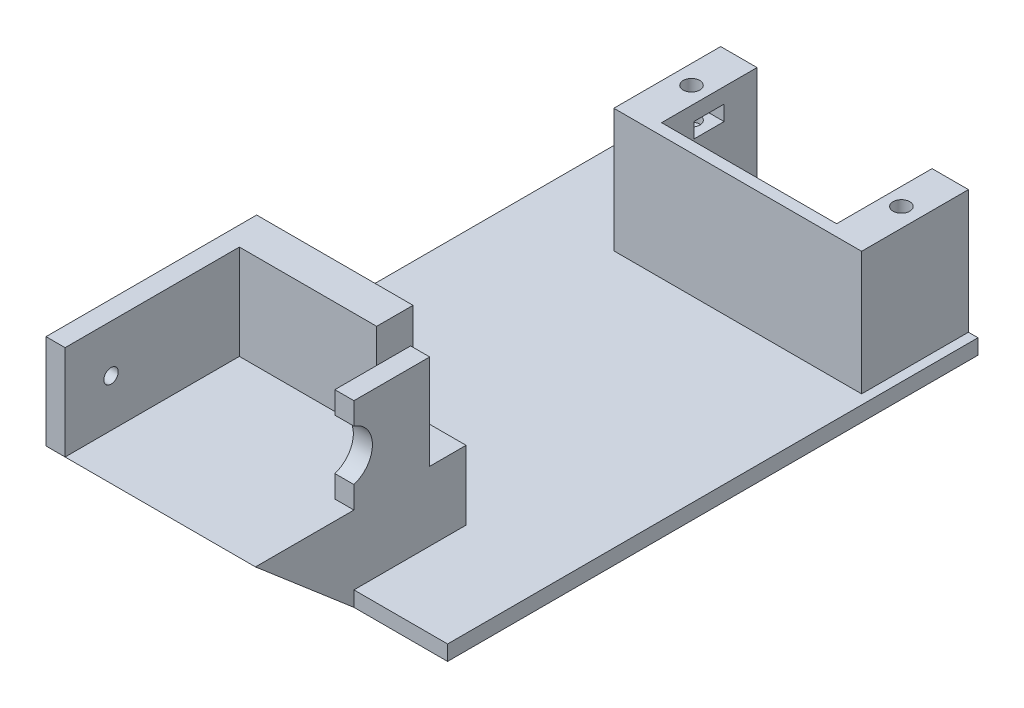
from build123d import *

# Parameters (mm, degrees)
SKETCH1_W           = 46
SKETCH1_H           = 70
BOSS_EXTRUDE1_DEPTH = 2
BOSS_EXTRUDE2_DEPTH = 16.3
SKETCH3_W           = 23.1
SKETCH3_H           = 12.6
CUT_EXTRUDE1_DEPTH  = 45.940961271
SKETCH4_W           = 34
SKETCH4_H           = 14.8
BOSS_EXTRUDE3_DEPTH = 11.125
BOSS_EXTRUDE4_DEPTH = 12.5
SKETCH7_W           = 6.36
SKETCH7_H           = 14.8
CUT_EXTRUDE2_DEPTH  = 9.125
SKETCH8_W           = 13
SKETCH8_H           = 12.5
SKETCH8_R           = 0.95
BOSS_EXTRUDE5_DEPTH = 2.52
BOSS_EXTRUDE6_DEPTH = 27.64
SKETCH10_W          = 7
SKETCH10_H          = 4.8
CUT_EXTRUDE3_DEPTH  = 12.5
SKETCH11_R          = 3.5
CUT_EXTRUDE4_DEPTH  = 10
SKETCH12_R          = 1.1
CUT_EXTRUDE5_DEPTH  = 8
CUT_EXTRUDE6_DEPTH  = 1.8
SKETCH14_R          = 1.1
CUT_EXTRUDE7_DEPTH  = 5
CUT_EXTRUDE8_DEPTH  = 2


with BuildPart() as part:
    # Sketch1 → Boss-Extrude1 (new body)
    with BuildSketch(Plane(origin=(0, 0, 0), x_dir=(1, 0, 0), z_dir=(0, 1, 0))):
        Rectangle(SKETCH1_W, SKETCH1_H)
    extrude(amount=BOSS_EXTRUDE1_DEPTH)

    # Sketch2 → Boss-Extrude2 (add)
    with BuildSketch(Plane(origin=(0, 2, 0), x_dir=(1, 0, 0), z_dir=(0, 1, 0))):
        Polygon((16.94, 22.4), (16.94, 35), (21.74, 35), (21.74, 20.9), (-10.96, 20.9), (-10.96, 35), (-6.16, 35), (-6.16, 22.4), align=None)
    extrude(amount=BOSS_EXTRUDE2_DEPTH)

    # Sketch3 → Cut-Extrude1 (cut, through all)
    with BuildSketch(Plane(origin=(0, 2, 0), x_dir=(1, 0, 0), z_dir=(0, 1, 0))):
        with Locations((5.39, 28.7)):
            Rectangle(SKETCH3_W, SKETCH3_H)
    extrude(amount=-CUT_EXTRUDE1_DEPTH, mode=Mode.SUBTRACT)

    # Sketch4 → Boss-Extrude3 (add)
    with BuildSketch(Plane.XZ):
        with Locations((0, 27.6)):
            Rectangle(SKETCH4_W, SKETCH4_H)
    extrude(amount=-BOSS_EXTRUDE3_DEPTH)

    # Sketch5 → Boss-Extrude4 (add)
    with BuildSketch(Plane(origin=(0, 11.125, 0), x_dir=(1, 0, 0), z_dir=(0, 1, 0))):
        Polygon((-14.48, -35), (-17, -35), (-17, -20.2), (10.64, -20.2), (10.64, -35), (8.12, -35), (8.12, -25), (-14.48, -25), align=None)
    extrude(amount=BOSS_EXTRUDE4_DEPTH)

    # Sketch7 → Cut-Extrude2 (cut)
    with BuildSketch(Plane(origin=(0, 11.125, 0), x_dir=(1, 0, 0), z_dir=(0, 1, 0))):
        with Locations((13.82, -27.6)):
            Rectangle(SKETCH7_W, SKETCH7_H)
    extrude(amount=-CUT_EXTRUDE2_DEPTH, mode=Mode.SUBTRACT)

    # Sketch8 → Boss-Extrude5 (add)
    with BuildSketch(Plane(origin=(-14.48, 0, 0), x_dir=(0, 0, -1), z_dir=(1, 0, 0))):
        with Locations((-41.5, 17.375)):
            Rectangle(SKETCH8_W, SKETCH8_H)
        with Locations((-41.939, 17.375)):
            Circle(SKETCH8_R, mode=Mode.SUBTRACT)
    extrude(amount=-BOSS_EXTRUDE5_DEPTH)

    # Sketch9 → Boss-Extrude6 (add)
    with BuildSketch(Plane.ZY.offset(17)):
        Polygon((48, 11.125), (35, 0), (35, 11.125), align=None)
    extrude(amount=-BOSS_EXTRUDE6_DEPTH)

    # Sketch10 → Cut-Extrude3 (cut)
    with BuildSketch(Plane(origin=(0, 23.625, 0), x_dir=(1, 0, 0), z_dir=(0, 1, 0))):
        with Locations((7.14, -22.6)):
            Rectangle(SKETCH10_W, SKETCH10_H)
    extrude(amount=-CUT_EXTRUDE3_DEPTH, mode=Mode.SUBTRACT)

    # Sketch11 → Cut-Extrude4 (cut)
    with BuildSketch(Plane(origin=(10.64, 0, 0), x_dir=(0, 0, -1), z_dir=(1, 0, 0))):
        with Locations((-36.06, 17.375)):
            Circle(SKETCH11_R)
    extrude(amount=-CUT_EXTRUDE4_DEPTH, mode=Mode.SUBTRACT)

    # Sketch12 → Cut-Extrude5 (cut)
    with BuildSketch(Plane(origin=(3.64, 0, 0), x_dir=(0, 0, -1), z_dir=(1, 0, 0))):
        with Locations((-22.62, 17.375)):
            Circle(SKETCH12_R)
    extrude(amount=-CUT_EXTRUDE5_DEPTH, mode=Mode.SUBTRACT)

    # Sketch13 → Cut-Extrude6 (cut)
    with BuildSketch(Plane(origin=(1.64, 0, 0), x_dir=(0, 0, -1), z_dir=(1, 0, 0))):
        Polygon((-21.494166975, 19.325), (-19.2, 19.325), (-19.2, 15.425), (-21.494166975, 15.425), (-23.745833025, 15.425), (-24.87166605, 17.375), (-23.745833025, 19.325), align=None)
    extrude(amount=-CUT_EXTRUDE6_DEPTH, mode=Mode.SUBTRACT)

    # Sketch14 → Cut-Extrude7 (cut)
    with BuildSketch(Plane(origin=(0, 18.3, 0), x_dir=(1, 0, 0), z_dir=(0, 1, 0))):
        with Locations(Location((-8.46, 28.65, 0), (0, 0, 270))):
            Circle(SKETCH14_R)
        with Locations(Location((19.24, 28.65, 0), (0, 0, 270))):
            Circle(SKETCH14_R)
    extrude(amount=-CUT_EXTRUDE7_DEPTH, mode=Mode.SUBTRACT)

    # Sketch15 → Cut-Extrude8 (cut)
    with BuildSketch(Plane(origin=(0, 16.3, 0), x_dir=(1, 0, 0), z_dir=(0, 1, 0))):
        Polygon((18.085299462, 30.65), (16.94, 30.65), (16.94, 26.65), (18.085299462, 26.65), (20.394700538, 26.65), (21.549401077, 28.65), (20.394700538, 30.65), align=None)
        Polygon((-6.16, 26.65), (-7.305299462, 26.65), (-9.614700538, 26.65), (-10.769401077, 28.65), (-9.614700538, 30.65), (-7.305299462, 30.65), (-6.16, 30.65), align=None)
    extrude(amount=-CUT_EXTRUDE8_DEPTH, mode=Mode.SUBTRACT)


solid = part.part
